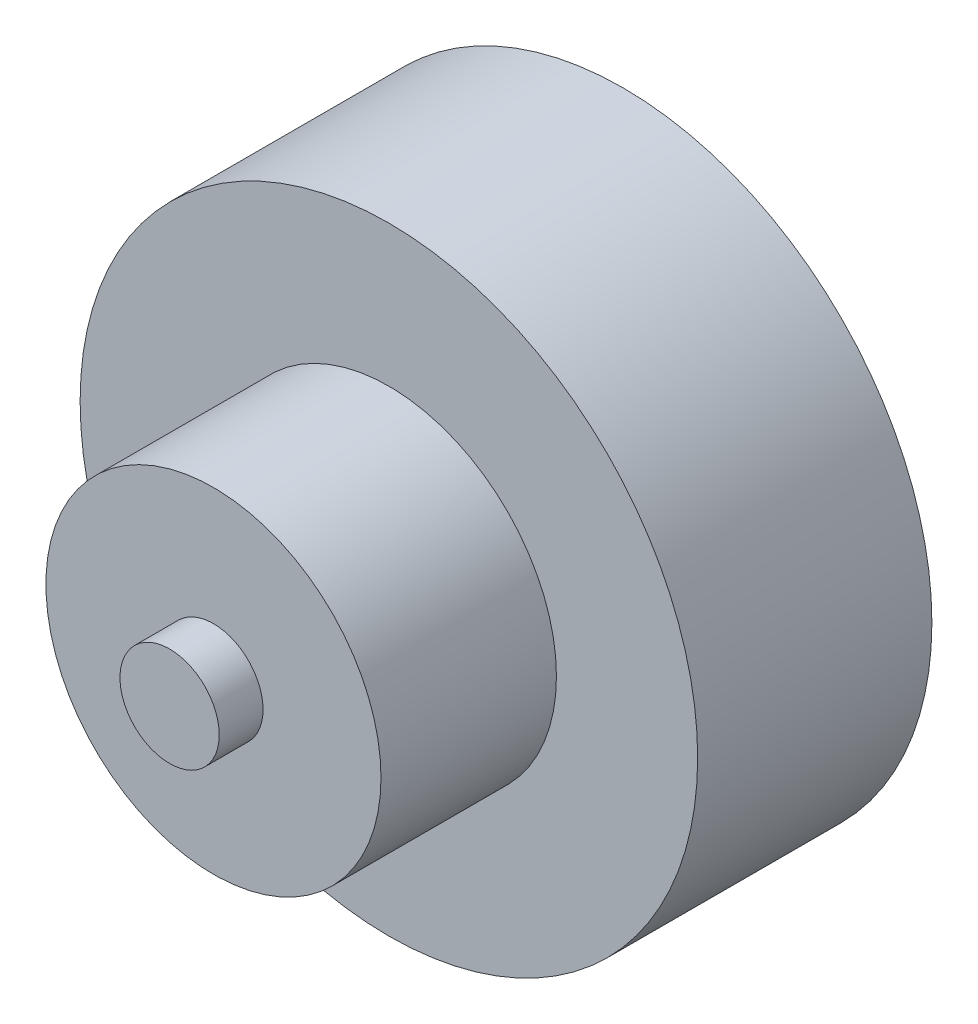
from build123d import *


with BuildPart() as part:
    # Sketch1 → Revolve1 (revolve)
    with BuildSketch(Plane(origin=(0, 0, 0), x_dir=(0, 0, -1), z_dir=(1, 0, 0))):
        Polygon((0, 0), (-65.659, 0), (-65.659, 7.182450088), (-59.309, 7.182450088), (-59.309, 24.257), (-33.909, 24.257), (-33.909, 44.704), (0, 44.704), align=None)
    revolve(axis=Axis((0, 0, 0), (0, 0, -1)))

    # Sketch2 → Cut-Revolve5 (revolve, cut)
    with BuildSketch(Plane(origin=(0, 0, 0), x_dir=(0, 0, -1), z_dir=(1, 0, 0))):
        with BuildLine():
            Line((-5.08, 0), (248.92, 0))
            ThreePointArc((248.92, 0), (121.92, 127), (-5.08, 0))
        make_face()
    revolve(axis=Axis((0, 0, 5.08), (0, 0, -1)), mode=Mode.SUBTRACT)


solid = part.part
